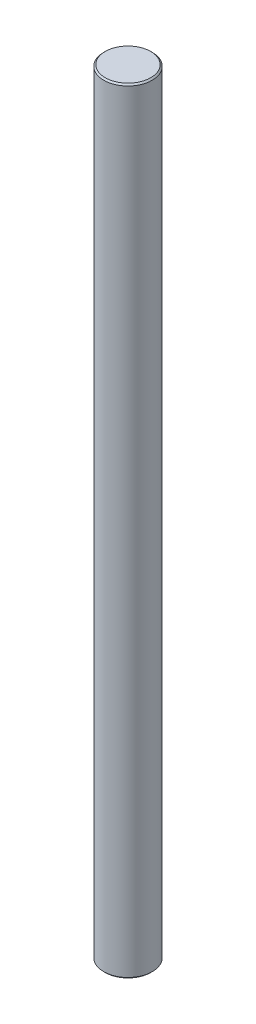
from build123d import *

# Parameters (mm, degrees)
SKETCH1_W     = 5
SKETCH1_H     = 160
CHAMFER1_SIZE = 0.3


with BuildPart() as part:
    # Sketch1 → Revolve1 (revolve)
    with BuildSketch(Plane.XY):
        with Locations((2.5, 80)):
            Rectangle(SKETCH1_W, SKETCH1_H)
    revolve(axis=Axis((0, 160, 0), (0, -1, 0)))

    # Chamfer1
    chamfer1_edges = [part.edges().sort_by_distance(p)[0] for p in [
        (-5, 160, 0),
        (-5, 0, 0),
    ]]
    chamfer(chamfer1_edges, length=CHAMFER1_SIZE)


solid = part.part
